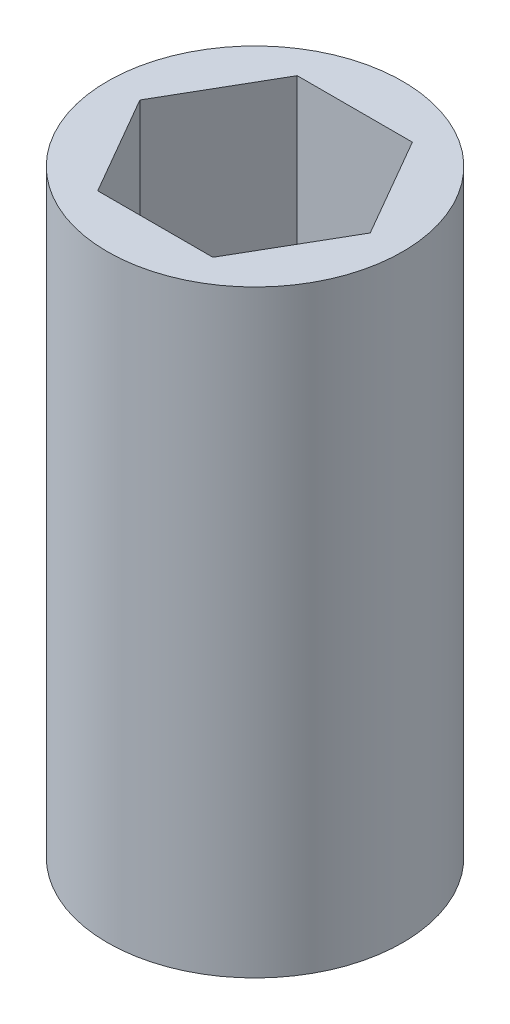
from build123d import *

# Parameters (mm, degrees)
SKETCH1_R           = 7.14375
BOSS_EXTRUDE1_DEPTH = 14.478


with BuildPart() as part:
    # Sketch1 → Boss-Extrude1 (new, symmetric)
    with BuildSketch(Plane(origin=(0, 0, 0), x_dir=(1, 0, 0), z_dir=(0, 1, 0))):
        with Locations(Location((0, 0, 0), (0, 0, 270))):
            Circle(SKETCH1_R)
        Polygon((2.786292399, -4.826), (5.572584798, 0), (2.786292399, 4.826), (-2.786292399, 4.826), (-5.572584798, 0), (-2.786292399, -4.826), align=None, mode=Mode.SUBTRACT)
    extrude(amount=BOSS_EXTRUDE1_DEPTH, both=True)


solid = part.part
